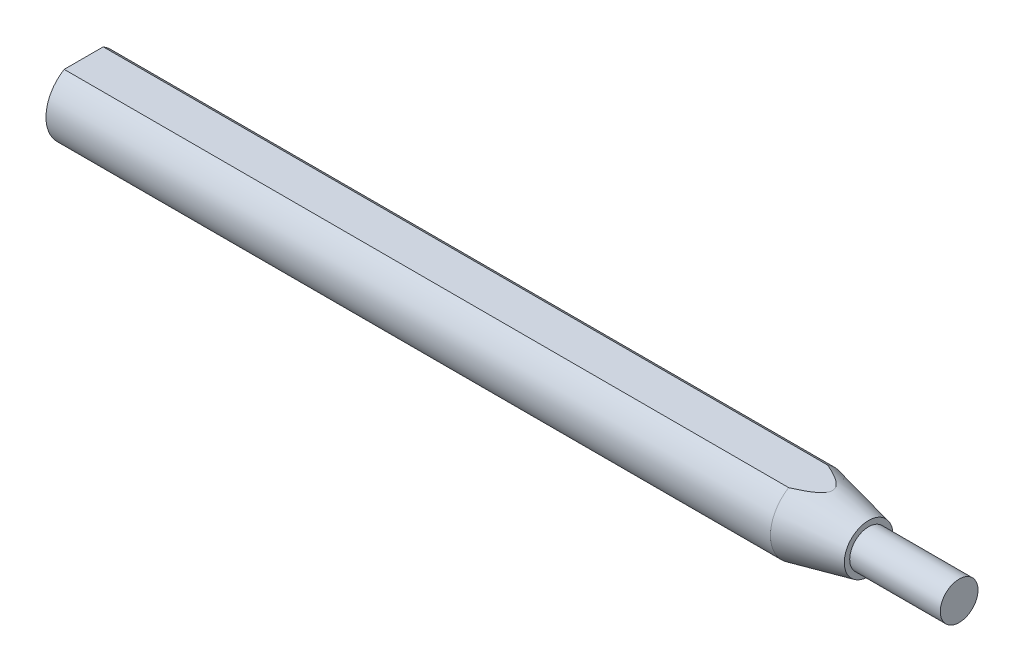
from build123d import *

# Parameters (mm, degrees)
SKETCH1_R           = 3.175
BOSS_EXTRUDE1_DEPTH = 60.96
SKETCH2_R           = 1.5875
BOSS_EXTRUDE2_DEPTH = 12.7
CUT_EXTRUDE1_DEPTH  = 74.796726553


with BuildPart() as part:
    # Sketch1 → Boss-Extrude1 (new body)
    with BuildSketch(Plane(origin=(0, 0, 0), x_dir=(0, 0, -1), z_dir=(1, 0, 0))):
        with Locations(Location((0, 0, 0), (0, 0, 180))):
            Circle(SKETCH1_R)
    extrude(amount=BOSS_EXTRUDE1_DEPTH)

    # Sketch2 → Boss-Extrude2 (add)
    with BuildSketch(Plane(origin=(60.96, 0, 0), x_dir=(0, 0, -1), z_dir=(1, 0, 0))):
        Circle(SKETCH2_R)
    extrude(amount=BOSS_EXTRUDE2_DEPTH)

    # Sketch4 → Revolve1 (revolve)
    with BuildSketch(Plane.XY, mode=Mode.PRIVATE) as revolve1_sk:
        Polygon((60.96, -1.5875), (66.04, -1.5875), (66.04, -2.0447), (60.96, -3.175), align=None)
    revolve(revolve1_sk.sketch.rotate(Axis((60.96, 0, 0), (1, 0, 0)), 270), axis=Axis((60.96, 0, 0), (1, 0, 0)))

    # Sketch3 → Cut-Extrude1 (cut, through all)
    with BuildSketch(Plane.ZY):
        with BuildLine():
            Line((1.641398233, 2.7178), (-1.641398233, 2.7178))
            ThreePointArc((-1.641398233, 2.7178), (0, 3.175), (1.641398233, 2.7178))
        make_face()
    extrude(amount=-CUT_EXTRUDE1_DEPTH, mode=Mode.SUBTRACT)


solid = part.part
